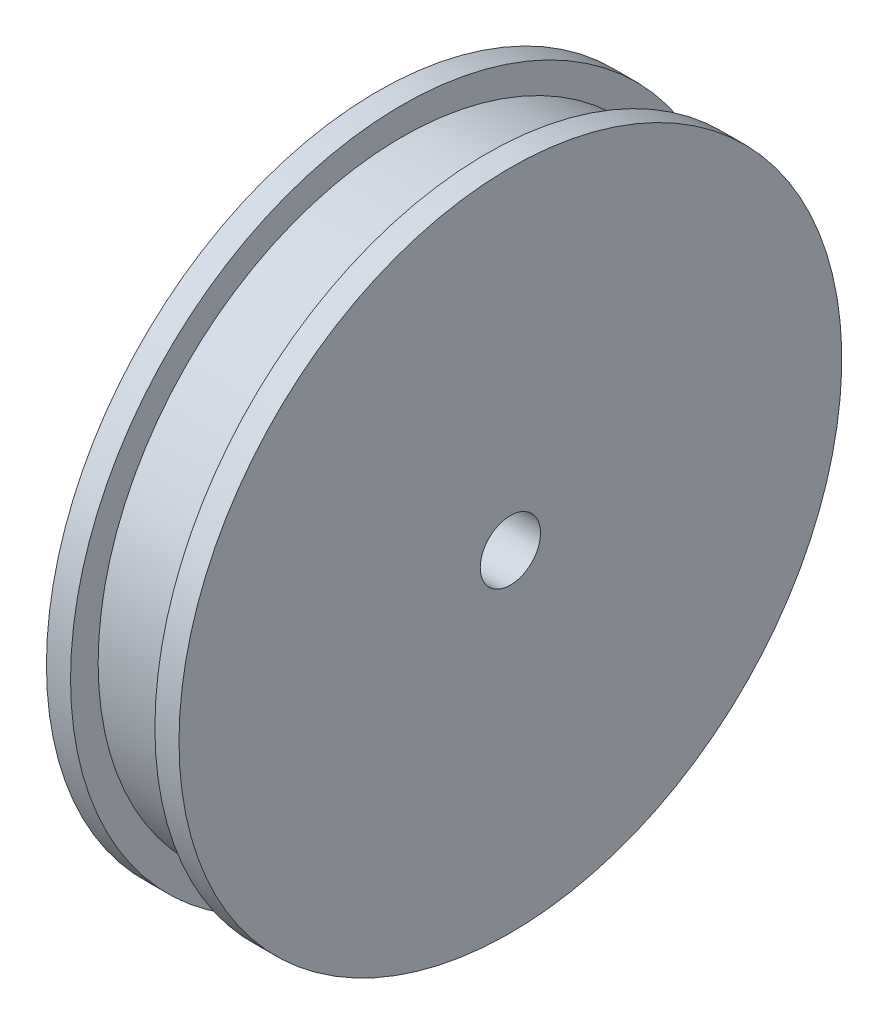
from build123d import *


with BuildPart() as part:
    # Sketch1 → Revolve1 (revolve)
    with BuildSketch(Plane(origin=(0, 0, 0), x_dir=(1, 0, 0), z_dir=(0, 1, 0))):
        Polygon((0, -2.5), (0, -15), (7, -15), (7, -27.5), (9, -27.5), (9, -25.21), (16, -25.21), (16, -27.5), (18, -27.5), (18, -2.5), align=None)
    revolve(axis=Axis((0, 0, 0), (1, 0, 0)))


solid = part.part
